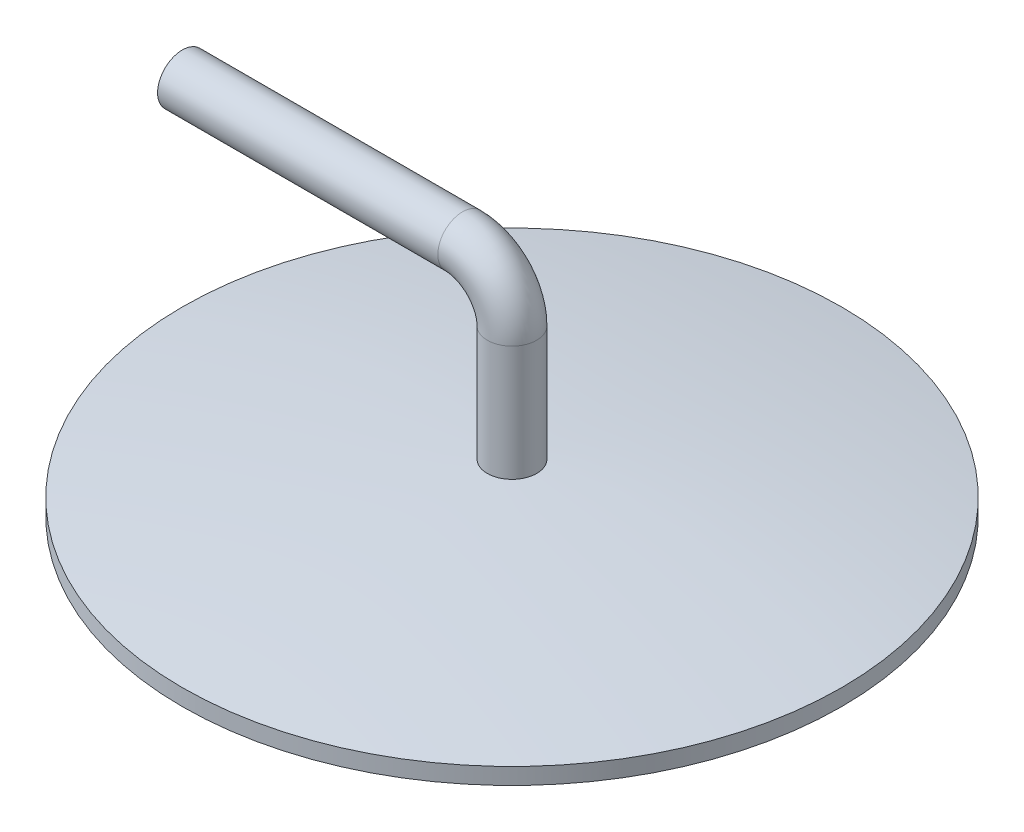
from build123d import *

# Parameters (mm, degrees)
SKETCH2_R   = 15
SKETCH2_R_2 = 10


with BuildPart() as part:
    # Sketch1 → Revolve2 (revolve)
    with BuildSketch(Plane(origin=(0, 0, 0), x_dir=(0, 0, -1), z_dir=(1, 0, 0))):
        with BuildLine():
            Line((0, 30), (-15, 30))
            ThreePointArc((-15, 30), (-107.836049883, 23.108461417), (-200, 10))
            Line((-200, 10), (-200, 0))
            Line((-200, 0), (0, 0))
            Line((0, 0), (0, 30))
        make_face()
    revolve(axis=Axis((0, 30, 0), (0, -1, 0)))

    # Sweep1: sweep along a path in Sketch3
    with BuildLine(Plane.XY) as sweep1_path:
        Line((0, 30), (0, 100))
        ThreePointArc((0, 100), (-8.786796564, 121.213203436), (-30, 130))
        Line((-30, 130), (-200, 130))
    # Sketch2 → Sweep1 (sweep)
    with BuildSketch(Plane(origin=(0, 30, 0), x_dir=(1, 0, 0), z_dir=(0, 1, 0))):
        Circle(SKETCH2_R)
        Circle(SKETCH2_R_2, mode=Mode.SUBTRACT)
    sweep(path=sweep1_path.line)


solid = part.part
